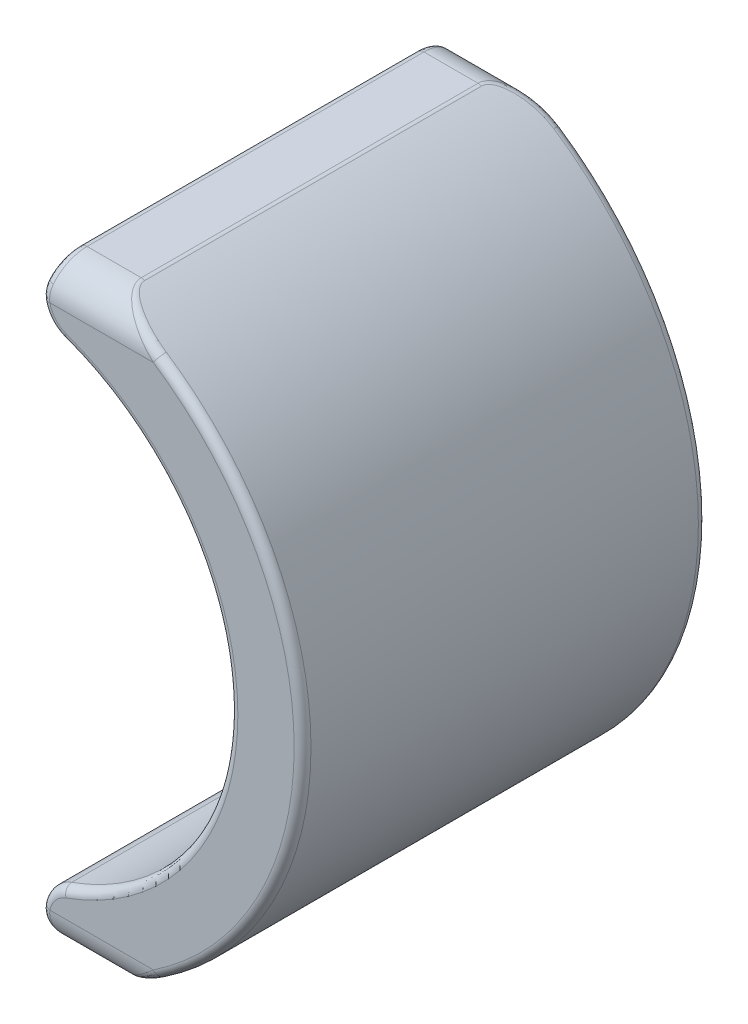
from build123d import *

# Parameters (mm, degrees)
BOSS_EXTRUDE1_DEPTH = 6
FILLET1_R           = 1
FILLET2_R           = 1
FILLET3_R           = 0.25


with BuildPart() as part:
    # Sketch1 → Boss-Extrude1 (new, symmetric)
    with BuildSketch(Plane.XY):
        with BuildLine():
            Line((3.893448911, -8.807834897), (2.033448911, -8.807834897))
            Line((2.033448911, -8.807834897), (1.677911896, -7.267834897))
            ThreePointArc((1.677911896, -7.267834897), (7.45900881, 0), (1.677911896, 7.267834897))
            Line((1.677911896, 7.267834897), (2.033448911, 8.807834897))
            Line((2.033448911, 8.807834897), (3.893448911, 8.807834897))
            ThreePointArc((3.893448911, 8.807834897), (9.63, 0), (3.893448911, -8.807834897))
        make_face()
    extrude(amount=BOSS_EXTRUDE1_DEPTH, both=True)

    # Fillet1
    fillet1_edges = [part.edges().sort_by_distance(p)[0] for p in [
        (1.677911896, -7.267834897, 0),
        (1.677911896, 7.267834897, 0),
    ]]
    fillet(fillet1_edges, radius=FILLET1_R)

    # Fillet2
    fillet2_edges = [part.edges().sort_by_distance(p)[0] for p in [
        (2.963448911, -8.807834897, -6),
        (2.963448911, -8.807834897, 6),
        (2.963448911, 8.807834897, -6),
        (2.963448911, 8.807834897, 6),
    ]]
    fillet(fillet2_edges, radius=FILLET2_R)

    # Fillet3
    fillet3_edges = [part.edges().sort_by_distance(p)[0] for p in [
        (7.45900881, 0, -6),
        (2.091886445, 7.323839054, -6),
        (7.45900881, 0, 6),
        (2.091886445, -7.323839054, 6),
        (3.893448911, -8.807834897, 0),
        (2.033448911, -8.807834897, 0),
        (9.63, 0, -6),
        (3.893448911, 8.807834897, 0),
        (9.63, 0, 6),
        (4.643337644, 8.436605689, 5.777590673),
        (4.643337643, 8.43660569, -5.777590675),
        (4.643337625, -8.4366057, 5.777590664),
        (4.643337624, -8.4366057, -5.777590664),
        (2.091886445, -7.323839054, -6),
        (1.864723647, -8.000289097, 5.981305956),
        (1.864723646, -8.000289093, -5.981305937),
        (1.99362755, -8.635349637, 5.561443992),
        (1.99362755, -8.635349637, -5.561443992),
        (2.091886445, 7.323839054, 6),
        (2.033448911, 8.807834897, 0),
        (1.99362755, 8.635349637, 5.561443992),
        (1.99362755, 8.635349637, -5.561443992),
        (1.864723638, 8.000289099, 5.981305958),
        (1.864723639, 8.000289099, -5.981305958),
    ]]
    fillet(fillet3_edges, radius=FILLET3_R)


solid = part.part
